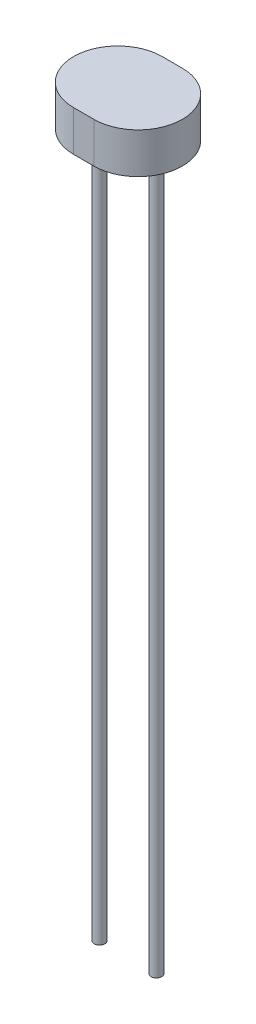
from build123d import *

# Parameters (mm, degrees)
SALIENTE_EXTRUIR1_DEPTH = 1.9
CROQUIS3_R              = 0.25
SALIENTE_EXTRUIR2_DEPTH = 33.4


with BuildPart() as part:
    # Croquis1 → Saliente-Extruir1 (new body)
    with BuildSketch(Plane(origin=(0, 0, 0), x_dir=(1, 0, 0), z_dir=(0, 1, 0))):
        with BuildLine():
            Line((-0.475, 2.075), (0.475, 2.075))
            ThreePointArc((0.475, 2.075), (2.55, 0), (0.475, -2.075))
            Line((0.475, -2.075), (-0.475, -2.075))
            ThreePointArc((-0.475, -2.075), (-2.55, 0), (-0.475, 2.075))
        make_face()
    extrude(amount=SALIENTE_EXTRUIR1_DEPTH)

    # Croquis3 → Saliente-Extruir2 (add)
    with BuildSketch(Plane.XZ):
        with Locations(Location((-1.333712644, 0, 0), (0, 0, 90))):
            Circle(CROQUIS3_R)
        with Locations(Location((1.333712644, 0, 0), (0, 0, 90))):
            Circle(CROQUIS3_R)
    extrude(amount=SALIENTE_EXTRUIR2_DEPTH)


solid = part.part
